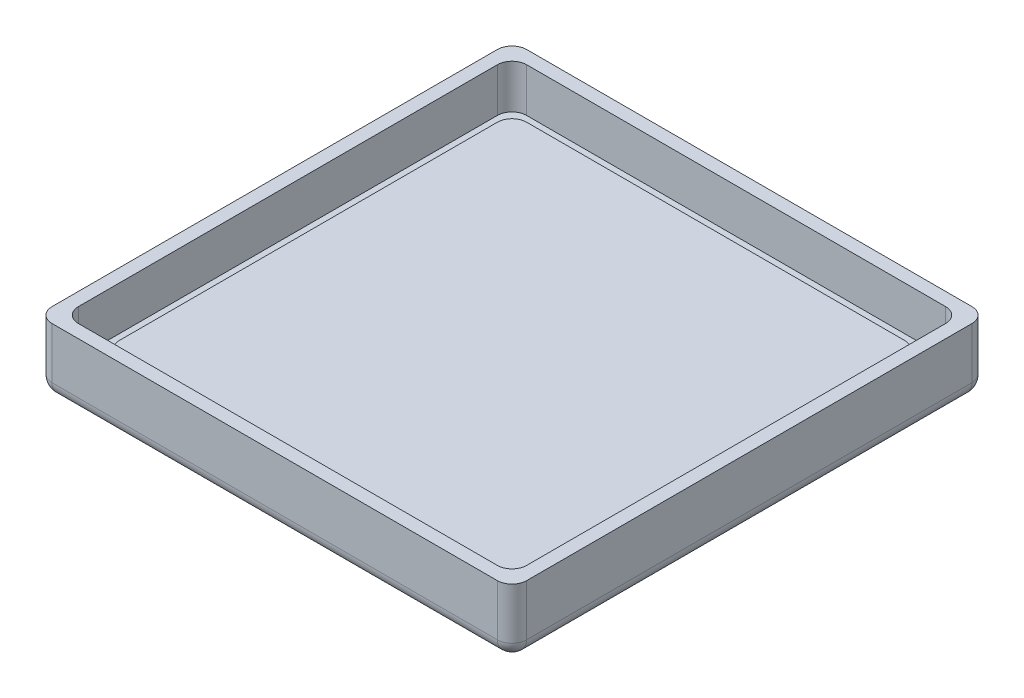
from build123d import *

# Parameters (mm, degrees)
SKETCH1_W           = 162
SKETCH1_H           = 162
SKETCH1_W_2         = 140
SKETCH1_H_2         = 140
BOSS_EXTRUDE1_DEPTH = 7.5
SKETCH2_W           = 139
SKETCH2_H           = 139
BOSS_EXTRUDE2_DEPTH = 5
FILLET1_R           = 5
BOSS_EXTRUDE3_START = 15
BOSS_EXTRUDE3_DEPTH = 15


with BuildPart() as part:
    # Sketch1 → Boss-Extrude1 (new body)
    # profile 1 of 2: a face of its own
    with BuildSketch(Plane(origin=(0, 0, 0), x_dir=(1, 0, 0), z_dir=(0, 1, 0))):
        with Locations((81, 81)):
            Rectangle(SKETCH1_W, SKETCH1_H)
        with Locations((81, 81)):
            Rectangle(SKETCH1_W_2, SKETCH1_H_2, mode=Mode.SUBTRACT)
    # profile 2 of 2: a face of its own
    with BuildSketch(Plane(origin=(0, 0, 0), x_dir=(1, 0, 0), z_dir=(0, 1, 0))):
        with Locations((81, 81)):
            Rectangle(SKETCH1_W_2, SKETCH1_H_2)
    extrude(amount=BOSS_EXTRUDE1_DEPTH)

    # Sketch2 → Boss-Extrude2 (add)
    with BuildSketch(Plane(origin=(0, 7.5, 0), x_dir=(1, 0, 0), z_dir=(0, 1, 0))):
        with Locations((81, 81)):
            Rectangle(SKETCH2_W, SKETCH2_H)
    extrude(amount=BOSS_EXTRUDE2_DEPTH)

    # Fillet1
    fillet1_edges = [part.edges().sort_by_distance(p)[0] for p in [
        (11.5, 10, -150.5),
        (11.5, 10, -11.5),
        (150.5, 10, -11.5),
        (150.5, 10, -150.5),
        (0, 0, -81),
        (81, 0, -162),
        (162, 0, -81),
        (81, 0, 0),
        (0, 3.75, 0),
        (0, 3.75, -162),
        (162, 3.75, -162),
        (162, 3.75, 0),
    ]]
    fillet(fillet1_edges, radius=FILLET1_R)

    # Sketch3 → Boss-Extrude3 (add)
    with BuildSketch(Plane(origin=(0, 7.5, 0), x_dir=(1, 0, 0), z_dir=(0, 1, 0)).offset(BOSS_EXTRUDE3_START)):
        with BuildLine():
            ThreePointArc((5, 162), (1.464466094, 160.535533906), (0, 157))
            Line((0, 157), (0, 5))
            ThreePointArc((0, 5), (1.464466094, 1.464466094), (5, 0))
            Line((5, 0), (157, 0))
            ThreePointArc((157, 0), (160.535533906, 1.464466094), (162, 5))
            Line((162, 5), (162, 157))
            ThreePointArc((162, 157), (160.535533906, 160.535533906), (157, 162))
            Line((157, 162), (5, 162))
        make_face()
        with BuildLine():
            ThreePointArc((9.5, 157.5), (5.964466094, 156.035533906), (4.5, 152.5))
            Line((4.5, 152.5), (4.5, 9.5))
            ThreePointArc((4.5, 9.5), (5.964466094, 5.964466094), (9.5, 4.5))
            Line((9.5, 4.5), (152.5, 4.5))
            ThreePointArc((152.5, 4.5), (156.035533906, 5.964466094), (157.5, 9.5))
            Line((157.5, 9.5), (157.5, 152.5))
            ThreePointArc((157.5, 152.5), (156.035533906, 156.035533906), (152.5, 157.5))
            Line((152.5, 157.5), (9.5, 157.5))
        make_face(mode=Mode.SUBTRACT)
    extrude(amount=-BOSS_EXTRUDE3_DEPTH)


solid = part.part
